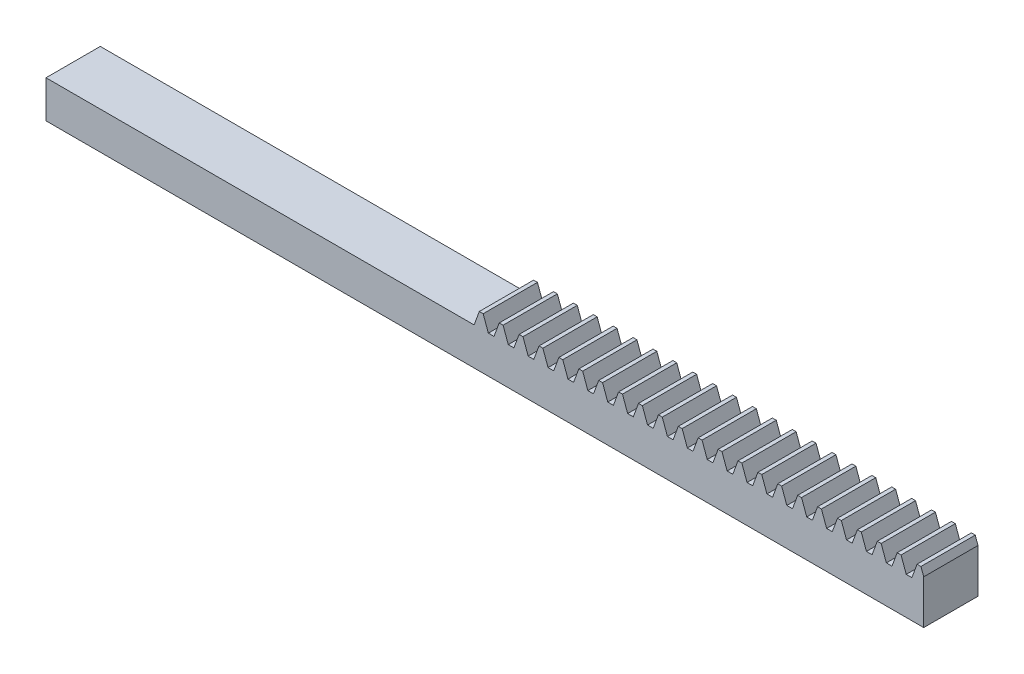
from build123d import *

# Parameters (mm, degrees)
BLANKSKE_W        = 50
BLANKSKE_H        = 5.7
BLANK_DEPTH       = 6
TOOTHCUTSIM_DEPTH = 51.680272296
TEETHCUTS_COUNT   = 24
TEETHCUTS_PITCH   = 2.199114855
SKETCH_1_W        = 6
SKETCH_1_H        = 4.125
EXTRUDE_1_DEPTH   = 47


with BuildPart() as part:
    # BlankSke → Blank (new body)
    with BuildSketch(Plane.XY):
        with Locations((25, 2.85)):
            Rectangle(BLANKSKE_W, BLANKSKE_H)
    extrude(amount=-BLANK_DEPTH)

    # TooCutSkeSim → ToothCutSim (cut, through all)
    with BuildSketch(Plane.XY):
        Polygon((0.312304759, 4.125), (-0.312304759, 4.125), (-0.894802722, 5.7254), (0.894802722, 5.7254), align=None)
    toothcutsim = extrude(amount=-TOOTHCUTSIM_DEPTH, mode=Mode.SUBTRACT)

    # TeethCuts: ToothCutSim ×24
    with Locations(*[(i * TEETHCUTS_PITCH, 0, 0) for i in range(1, TEETHCUTS_COUNT)]):
        add(toothcutsim, mode=Mode.SUBTRACT)

    # 草图1 → 凸台-拉伸1 (add)
    with BuildSketch(Plane.ZY):
        with Locations((-3, 2.0625)):
            Rectangle(SKETCH_1_W, SKETCH_1_H)
    extrude(amount=EXTRUDE_1_DEPTH)


solid = part.part
